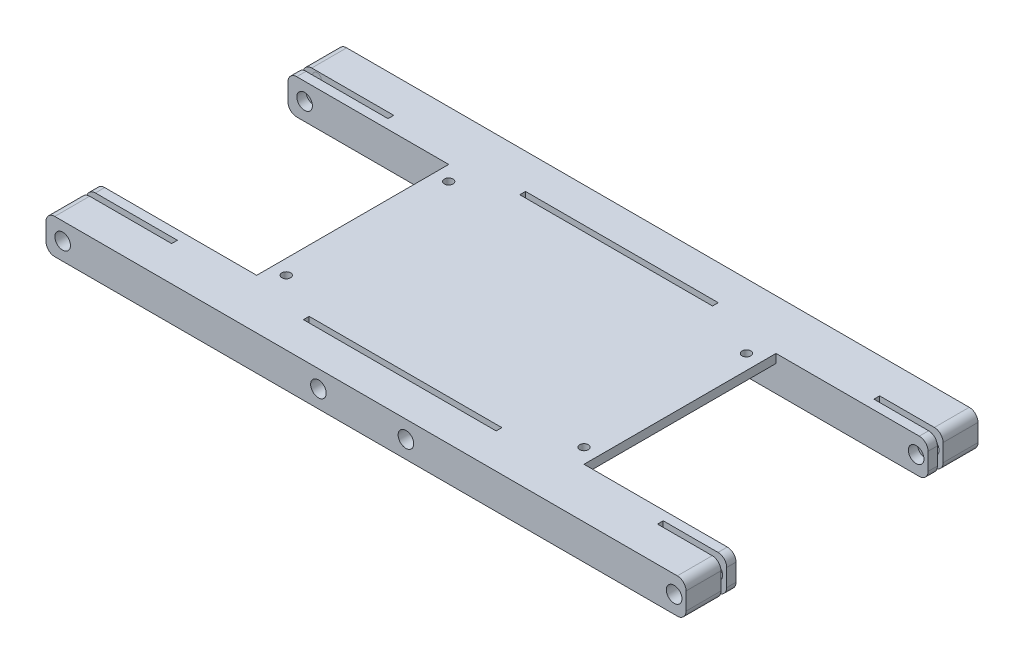
from build123d import *

# Parameters (mm, degrees)
SKETCH1_R                 = 1.6
SKETCH1_R_2               = 1.5
BOSS_EXTRUDE3_DEPTH       = 3.2
LPATTERN2_COUNT           = 2
LPATTERN2_PITCH           = 6.8
SKETCH9_W                 = 9.22
SKETCH9_H                 = 12
BOSS_EXTRUDE5_DEPTH       = 3.7
SKETCH11_W                = 60.430595346
SKETCH11_H                = 12
BOSS_EXTRUDE6_DEPTH       = 3.7
LPATTERN3_COUNT           = 2
LPATTERN3_PITCH           = 76
SKETCH13_W                = 112.501798465
SKETCH13_H                = 66
BOSS_EXTRUDE8_DEPTH       = 3
SKETCH14_R                = 1.5
CUT_EXTRUDE2_DEPTH        = 4.318
SKETCH22_W                = 5.174861703
SKETCH22_H                = 10.217447179
BOSS_EXTRUDE9_DEPTH       = 4.318
BOSS_EXTRUDE10_DEPTH      = 12.446
BOSS_EXTRUDE10_DEPTH_BACK = 4.826
SKETCH31_R                = 1.5
SKETCH31_R_2              = 1.6
BOSS_EXTRUDE13_DEPTH      = 12.446
BOSS_EXTRUDE13_DEPTH_BACK = 4.826
SKETCH34_R                = 1.5
SKETCH34_R_2              = 1.6
SCALE1_SCALE              = 1.5
SKETCH36_R                = 2.25
SKETCH36_R_2              = 2.4
CUT_EXTRUDE3_DEPTH        = 7.91
CUT_EXTRUDE4_START        = -7.91
SKETCH39_R                = 2.25
SKETCH39_R_2              = 2.4
CUT_EXTRUDE4_DEPTH        = 7.91
SKETCH42_W                = 2.961
SKETCH42_H                = 18
CUT_EXTRUDE5_DEPTH        = 6
SKETCH44_W                = 2.961
SKETCH44_H                = 18
CUT_EXTRUDE6_DEPTH        = 5
SKETCH45_W                = 2.961
SKETCH45_H                = 18
CUT_EXTRUDE7_DEPTH        = 56
SKETCH49_R                = 4.025
CUT_EXTRUDE9_DEPTH        = 164
BOSS_EXTRUDE14_START      = -18
SKETCH51_R                = 2.25
BOSS_EXTRUDE14_DEPTH      = 18
BOSS_EXTRUDE15_START      = -4.8
SKETCH53_R                = 2.25
BOSS_EXTRUDE15_DEPTH      = 4.8
SKETCH57_R                = 2.25
BOSS_EXTRUDE16_DEPTH      = 18
SKETCH58_R                = 2.25
BOSS_EXTRUDE17_DEPTH      = 4.8
SKETCH59_R                = 4.025
CUT_EXTRUDE11_DEPTH       = 182.8
CUT_EXTRUDE12_DEPTH       = 184.8
CUT_EXTRUDE12_DEPTH_BACK  = 76
SKETCH62_R                = 4.025
SKETCH65_W                = 2.961
SKETCH65_H                = 18
CUT_EXTRUDE13_DEPTH       = 5


with BuildPart() as part:
    # Sketch1 → Boss-Extrude3 (new body)
    with BuildSketch(Plane.XY):
        with BuildLine():
            Line((-103.947681543, 43.894483621), (110.052318457, 43.894483621))
            ThreePointArc((110.052318457, 43.894483621), (112.1736388, 43.015803964), (113.052318457, 40.894483621))
            Line((113.052318457, 40.894483621), (113.052318457, 34.894483621))
            ThreePointArc((113.052318457, 34.894483621), (112.1736388, 32.773163277), (110.052318457, 31.894483621))
            Line((110.052318457, 31.894483621), (-103.947681543, 31.894483621))
            ThreePointArc((-103.947681543, 31.894483621), (-106.069001887, 32.773163277), (-106.947681543, 34.894483621))
            Line((-106.947681543, 34.894483621), (-106.947681543, 40.894483621))
            ThreePointArc((-106.947681543, 40.894483621), (-106.069001887, 43.015803964), (-103.947681543, 43.894483621))
        make_face()
        with Locations((-102.125890736, 37.895486936)):
            Circle(SKETCH1_R, mode=Mode.SUBTRACT)
        with Locations((-102.125890736, 41.895486936)):
            Circle(SKETCH1_R_2, mode=Mode.SUBTRACT)
        with Locations((-102.125890736, 33.895486936)):
            Circle(SKETCH1_R_2, mode=Mode.SUBTRACT)
        with Locations((109.874217574, 37.891839711)):
            Circle(SKETCH1_R_2, mode=Mode.SUBTRACT)
        with Locations((-12.125890736, 37.895486936)):
            Circle(SKETCH1_R_2, mode=Mode.SUBTRACT)
        with Locations((17.874109264, 37.895486936)):
            Circle(SKETCH1_R_2, mode=Mode.SUBTRACT)
    extrude(amount=BOSS_EXTRUDE3_DEPTH)


with BuildPart() as lpattern2_1:
    # LPattern2: pattern copy
    add(part.part.moved(Location(Vector(0, 0, 1) * (1 * LPATTERN2_PITCH))))


with BuildPart() as part_1:
    add(part.part)

    add(lpattern2_1.part)  # Boss-Extrude5 merges LPattern2_1
    # Sketch9 → Boss-Extrude5 (add)
    with BuildSketch(Plane.XY.offset(3.2)):
        with Locations((3.052318457, 37.894483621)):
            Rectangle(SKETCH9_W, SKETCH9_H)
    extrude(amount=BOSS_EXTRUDE5_DEPTH)

    # Sketch11 → Boss-Extrude6 (add)
    with BuildSketch(Plane.XY.offset(3.2)):
        with Locations((61.010147688, 37.894483621)):
            Rectangle(SKETCH11_W, SKETCH11_H)
        Polygon((-79.696539418, 43.894483621), (-79.758832443, 43.894483621), (-79.758832443, 31.894483621), (-23.819696729, 31.894483621), (-23.819696729, 43.894483621), align=None)
    extrude(amount=BOSS_EXTRUDE6_DEPTH)


with BuildPart() as lpattern3_1:
    # LPattern3: pattern copy
    add(part_1.part.moved(Location(Vector(0, 0, 1) * (1 * LPATTERN3_PITCH))))


with BuildPart() as part_2:
    add(part_1.part)

    add(lpattern3_1.part)  # Boss-Extrude8 merges LPattern3_1
    # Sketch13 → Boss-Extrude8 (add)
    with BuildSketch(Plane(origin=(0, 43.894483621, 0), x_dir=(1, 0, 0), z_dir=(0, 1, 0))):
        with Locations((4.548532601, -43)):
            Rectangle(SKETCH13_W, SKETCH13_H)
    extrude(amount=-BOSS_EXTRUDE8_DEPTH)

    # Sketch14 → Cut-Extrude2 (cut)
    with BuildSketch(Plane(origin=(0, 43.894483621, 0), x_dir=(1, 0, 0), z_dir=(0, 1, 0))):
        with Locations(Location((-46.622366631, -15.08, 0), (0, 0, 270))):
            Circle(SKETCH14_R)
        with Locations(Location((55.719431834, -15.08, 0), (0, 0, 270))):
            Circle(SKETCH14_R)
        with Locations(Location((55.719431834, -70.92, 0), (0, 0, 270))):
            Circle(SKETCH14_R)
        with Locations(Location((-46.622366631, -70.92, 0), (0, 0, 270))):
            Circle(SKETCH14_R)
    extrude(amount=-CUT_EXTRUDE2_DEPTH, mode=Mode.SUBTRACT)

    # Sketch22 → Boss-Extrude9 (add)
    with BuildSketch(Plane.XZ.offset(-40.894483621)):
        with Locations((-36.737847825, 70.891276411)):
            Rectangle(SKETCH22_W, SKETCH22_H)
        with Locations((-21.497847826, 70.891276411)):
            Rectangle(SKETCH22_W, SKETCH22_H)
        with Locations((-6.257847826, 70.891276411)):
            Rectangle(SKETCH22_W, SKETCH22_H)
        with Locations((8.982152175, 70.891276411)):
            Rectangle(SKETCH22_W, SKETCH22_H)
        with Locations((24.222152175, 70.891276411)):
            Rectangle(SKETCH22_W, SKETCH22_H)
        with Locations((39.462152175, 70.891276411)):
            Rectangle(SKETCH22_W, SKETCH22_H)
        with Locations((-21.497847826, 15.011276411)):
            Rectangle(SKETCH22_W, SKETCH22_H)
        with Locations((-6.257847826, 15.011276411)):
            Rectangle(SKETCH22_W, SKETCH22_H)
        with Locations((8.982152175, 15.011276411)):
            Rectangle(SKETCH22_W, SKETCH22_H)
        with Locations((24.222152175, 15.011276411)):
            Rectangle(SKETCH22_W, SKETCH22_H)
        with Locations((39.462152175, 15.011276411)):
            Rectangle(SKETCH22_W, SKETCH22_H)
        with Locations((-36.737847825, 15.011276411)):
            Rectangle(SKETCH22_W, SKETCH22_H)
    extrude(amount=BOSS_EXTRUDE9_DEPTH)

    # Sketch31 → Boss-Extrude10 (add, two sides: drawn at the far end of the back side and taken through both)
    with BuildSketch(Plane(origin=(0, 0, 0), x_dir=(-1, 0, 0), z_dir=(0, 0, -1)).offset(-BOSS_EXTRUDE10_DEPTH_BACK)):
        with BuildLine():
            Line((-113.052318457, 34.894483621), (-113.052318457, 40.894483621))
            ThreePointArc((-113.052318457, 40.894483621), (-112.1736388, 43.015803964), (-110.052318457, 43.894483621))
            Line((-110.052318457, 43.894483621), (103.947681543, 43.894483621))
            ThreePointArc((103.947681543, 43.894483621), (106.069001887, 43.015803964), (106.947681543, 40.894483621))
            Line((106.947681543, 40.894483621), (106.947681543, 34.894483621))
            ThreePointArc((106.947681543, 34.894483621), (106.069001887, 32.773163277), (103.947681543, 31.894483621))
            Line((103.947681543, 31.894483621), (-110.052318457, 31.894483621))
            ThreePointArc((-110.052318457, 31.894483621), (-112.1736388, 32.773163277), (-113.052318457, 34.894483621))
        make_face()
        with Locations(Location((-109.874217574, 37.891839711, 0), (0, 0, 180))):
            Circle(SKETCH31_R, mode=Mode.SUBTRACT)
        with Locations(Location((-17.874109264, 37.895486936, 0), (0, 0, 180))):
            Circle(SKETCH31_R, mode=Mode.SUBTRACT)
        with Locations(Location((12.125890736, 37.895486936, 0), (0, 0, 180))):
            Circle(SKETCH31_R, mode=Mode.SUBTRACT)
        with Locations(Location((102.125890736, 37.895486936, 0), (0, 0, 180))):
            Circle(SKETCH31_R_2, mode=Mode.SUBTRACT)
        with Locations(Location((102.125890736, 41.895486936, 0), (0, 0, 180))):
            Circle(SKETCH31_R, mode=Mode.SUBTRACT)
        with Locations(Location((102.125890736, 33.895486936, 0), (0, 0, 180))):
            Circle(SKETCH31_R, mode=Mode.SUBTRACT)
    extrude(amount=BOSS_EXTRUDE10_DEPTH + BOSS_EXTRUDE10_DEPTH_BACK)

    # Sketch34 → Boss-Extrude13 (add, two sides: drawn at the far end of the back side and taken through both)
    with BuildSketch(Plane.XY.offset(86).offset(-BOSS_EXTRUDE13_DEPTH_BACK)):
        with BuildLine():
            Line((-106.947681543, 34.894483621), (-106.947681543, 40.894483621))
            ThreePointArc((-106.947681543, 40.894483621), (-106.069001887, 43.015803964), (-103.947681543, 43.894483621))
            Line((-103.947681543, 43.894483621), (110.052318457, 43.894483621))
            ThreePointArc((110.052318457, 43.894483621), (112.1736388, 43.015803964), (113.052318457, 40.894483621))
            Line((113.052318457, 40.894483621), (113.052318457, 34.894483621))
            ThreePointArc((113.052318457, 34.894483621), (112.1736388, 32.773163277), (110.052318457, 31.894483621))
            Line((110.052318457, 31.894483621), (-103.947681543, 31.894483621))
            ThreePointArc((-103.947681543, 31.894483621), (-106.069001887, 32.773163277), (-106.947681543, 34.894483621))
        make_face()
        with Locations((-102.125890736, 41.895486936)):
            Circle(SKETCH34_R, mode=Mode.SUBTRACT)
        with Locations((-102.125890736, 37.895486936)):
            Circle(SKETCH34_R_2, mode=Mode.SUBTRACT)
        with Locations((-102.125890736, 33.895486936)):
            Circle(SKETCH34_R, mode=Mode.SUBTRACT)
        with Locations((-12.125890736, 37.895486936)):
            Circle(SKETCH34_R, mode=Mode.SUBTRACT)
        with Locations((17.874109264, 37.895486936)):
            Circle(SKETCH34_R, mode=Mode.SUBTRACT)
        with Locations((109.874217574, 37.891839711)):
            Circle(SKETCH34_R, mode=Mode.SUBTRACT)
    extrude(amount=BOSS_EXTRUDE13_DEPTH + BOSS_EXTRUDE13_DEPTH_BACK)


with BuildPart() as part_3:
    # Scale1: scaled about (3.884417455, 38.64082927, 43.002179389)
    add(part_2.part.scale(SCALE1_SCALE).moved(Location((-1.942208727, -19.320414635, -21.501089694))))

    # Sketch36 → Cut-Extrude3 (cut)
    with BuildSketch(Plane(origin=(0, 0, -40.170089694), x_dir=(-1, 0, 0), z_dir=(0, 0, -1))):
        with BuildLine():
            Line((-167.636268957, 42.021310796), (-167.636268957, 33.021310796))
            ThreePointArc((-167.636268957, 33.021310796), (-166.318249473, 29.839330281), (-163.136268957, 28.521310796))
            Line((-163.136268957, 28.521310796), (157.863731043, 28.521310796))
            ThreePointArc((157.863731043, 28.521310796), (161.045711558, 29.839330281), (162.363731043, 33.021310796))
            Line((162.363731043, 33.021310796), (162.363731043, 42.021310796))
            ThreePointArc((162.363731043, 42.021310796), (161.045711558, 45.203291311), (157.863731043, 46.521310796))
            Line((157.863731043, 46.521310796), (-163.136268957, 46.521310796))
            ThreePointArc((-163.136268957, 46.521310796), (-166.318249473, 45.203291311), (-167.636268957, 42.021310796))
        make_face()
        with Locations((-162.869117633, 37.517344932)):
            Circle(SKETCH36_R, mode=Mode.SUBTRACT)
        with Locations((-24.868955168, 37.522815769)):
            Circle(SKETCH36_R, mode=Mode.SUBTRACT)
        with Locations((20.131044832, 37.522815769)):
            Circle(SKETCH36_R, mode=Mode.SUBTRACT)
        with Locations((155.131044832, 43.522815769)):
            Circle(SKETCH36_R, mode=Mode.SUBTRACT)
        with Locations((155.131044832, 37.522815769)):
            Circle(SKETCH36_R_2, mode=Mode.SUBTRACT)
        with Locations((155.131044832, 31.522815769)):
            Circle(SKETCH36_R, mode=Mode.SUBTRACT)
    extrude(amount=-CUT_EXTRUDE3_DEPTH, mode=Mode.SUBTRACT)

    # Sketch39 → Cut-Extrude4 (cut)
    with BuildSketch(Plane.XY.offset(126.167910306).offset(CUT_EXTRUDE4_START)):
        with BuildLine():
            Line((167.636268957, 42.021310796), (167.636268957, 33.021310796))
            ThreePointArc((167.636268957, 33.021310796), (166.318249473, 29.839330281), (163.136268957, 28.521310796))
            Line((163.136268957, 28.521310796), (-157.863731043, 28.521310796))
            ThreePointArc((-157.863731043, 28.521310796), (-161.045711558, 29.839330281), (-162.363731043, 33.021310796))
            Line((-162.363731043, 33.021310796), (-162.363731043, 42.021310796))
            ThreePointArc((-162.363731043, 42.021310796), (-161.045711558, 45.203291311), (-157.863731043, 46.521310796))
            Line((-157.863731043, 46.521310796), (163.136268957, 46.521310796))
            ThreePointArc((163.136268957, 46.521310796), (166.318249473, 45.203291311), (167.636268957, 42.021310796))
        make_face()
        with Locations((-155.131044832, 43.522815769)):
            Circle(SKETCH39_R, mode=Mode.SUBTRACT)
        with Locations((-155.131044832, 37.522815769)):
            Circle(SKETCH39_R_2, mode=Mode.SUBTRACT)
        with Locations((-155.131044832, 31.522815769)):
            Circle(SKETCH39_R, mode=Mode.SUBTRACT)
        with Locations((-20.131044832, 37.522815769)):
            Circle(SKETCH39_R, mode=Mode.SUBTRACT)
        with Locations((24.868955168, 37.522815769)):
            Circle(SKETCH39_R, mode=Mode.SUBTRACT)
        with Locations((162.869117633, 37.517344932)):
            Circle(SKETCH39_R, mode=Mode.SUBTRACT)
    extrude(amount=CUT_EXTRUDE4_DEPTH, mode=Mode.SUBTRACT)

    # Sketch42 → Cut-Extrude5 (cut)
    with BuildSketch(Plane.ZY.offset(121.580457392)):
        with Locations((-12.781589694, 37.521310796)):
            Rectangle(SKETCH42_W, SKETCH42_H)
        with Locations((98.779410306, 37.521310796)):
            Rectangle(SKETCH42_W, SKETCH42_H)
    extrude(amount=-CUT_EXTRUDE5_DEPTH, mode=Mode.SUBTRACT)

    # Sketch44 → Cut-Extrude6 (cut)
    with BuildSketch(Plane(origin=(-37.671753822, 0, 0), x_dir=(0, 0, -1), z_dir=(1, 0, 0))):
        with Locations((12.781589694, 37.521310796)):
            Rectangle(SKETCH44_W, SKETCH44_H)
        with Locations((-98.779410306, 37.521310796)):
            Rectangle(SKETCH44_W, SKETCH44_H)
    extrude(amount=-CUT_EXTRUDE6_DEPTH, mode=Mode.SUBTRACT)

    # Sketch45 → Cut-Extrude7 (cut)
    with BuildSketch(Plane.ZY.offset(4.278731043)):
        with Locations((-12.781589694, 37.521310796)):
            Rectangle(SKETCH45_W, SKETCH45_H)
        with Locations((98.779410306, 37.521310796)):
            Rectangle(SKETCH45_W, SKETCH45_H)
    extrude(amount=-CUT_EXTRUDE7_DEPTH, mode=Mode.SUBTRACT)

    # Sketch49 → Cut-Extrude9 (cut)
    with BuildSketch(Plane(origin=(0, 0, -32.260089694), x_dir=(-1, 0, 0), z_dir=(0, 0, -1))):
        with Locations((-161.4953833, 37.479254162)):
            Circle(SKETCH49_R)
    extrude(amount=-CUT_EXTRUDE9_DEPTH, mode=Mode.SUBTRACT)

    # Sketch51 → Boss-Extrude14 (add)
    with BuildSketch(Plane.XY.offset(118.257910306).offset(BOSS_EXTRUDE14_START)):
        with Locations(Location((-155.131044832, 43.522815769, 0), (0, 0, 180))):
            Circle(SKETCH51_R)
        with Locations(Location((-155.131044832, 31.522815769, 0), (0, 0, 180))):
            Circle(SKETCH51_R)
    extrude(amount=BOSS_EXTRUDE14_DEPTH)

    # Sketch53 → Boss-Extrude15 (add)
    with BuildSketch(Plane.XY.offset(97.298910306).offset(BOSS_EXTRUDE15_START)):
        with Locations(Location((-155.131044832, 43.522815769, 0), (0, 0, 180))):
            Circle(SKETCH53_R)
        with Locations(Location((-155.131044832, 31.522815769, 0), (0, 0, 180))):
            Circle(SKETCH53_R)
    extrude(amount=BOSS_EXTRUDE15_DEPTH)

    # Sketch57 → Boss-Extrude16 (add)
    with BuildSketch(Plane(origin=(0, 0, -32.260089694), x_dir=(-1, 0, 0), z_dir=(0, 0, -1))):
        with Locations(Location((155.131044832, 43.522815769, 0), (0, 0, 180))):
            Circle(SKETCH57_R)
        with Locations(Location((155.131044832, 31.522815769, 0), (0, 0, 180))):
            Circle(SKETCH57_R)
    extrude(amount=-BOSS_EXTRUDE16_DEPTH)

    # Sketch58 → Boss-Extrude17 (add)
    with BuildSketch(Plane(origin=(0, 0, -11.301089694), x_dir=(-1, 0, 0), z_dir=(0, 0, -1))):
        with Locations((155.131044832, 43.522815769)):
            Circle(SKETCH58_R)
        with Locations((155.131044832, 31.522815769)):
            Circle(SKETCH58_R)
    extrude(amount=-BOSS_EXTRUDE17_DEPTH)

    # Sketch59 → Cut-Extrude11 (cut)
    with BuildSketch(Plane(origin=(0, 0, -32.260089694), x_dir=(-1, 0, 0), z_dir=(0, 0, -1))):
        with Locations((153.782295776, 37.522815769)):
            Circle(SKETCH59_R)
    extrude(amount=-CUT_EXTRUDE11_DEPTH, mode=Mode.SUBTRACT)

    # Sketch62 → Cut-Extrude12 (cut, two sides: drawn at the far end of the back side and taken through both)
    with BuildSketch(Plane(origin=(0, 0, 92.498910306), x_dir=(-1, 0, 0), z_dir=(0, 0, -1)).offset(-CUT_EXTRUDE12_DEPTH_BACK)):
        with Locations((-23.208180354, 37.498361207)):
            Circle(SKETCH62_R)
        with Locations((21.89769901, 37.504593442)):
            Circle(SKETCH62_R)
    extrude(amount=CUT_EXTRUDE12_DEPTH + CUT_EXTRUDE12_DEPTH_BACK, mode=Mode.SUBTRACT)

    # Sketch65 → Cut-Extrude13 (cut)
    with BuildSketch(Plane(origin=(-42.671753822, 0, 0), x_dir=(0, 0, -1), z_dir=(1, 0, 0))):
        with Locations((12.781589694, 37.521310796)):
            Rectangle(SKETCH65_W, SKETCH65_H)
        with Locations((-98.779410306, 37.521310796)):
            Rectangle(SKETCH65_W, SKETCH65_H)
    extrude(amount=-CUT_EXTRUDE13_DEPTH, mode=Mode.SUBTRACT)


solid = part_3.part
